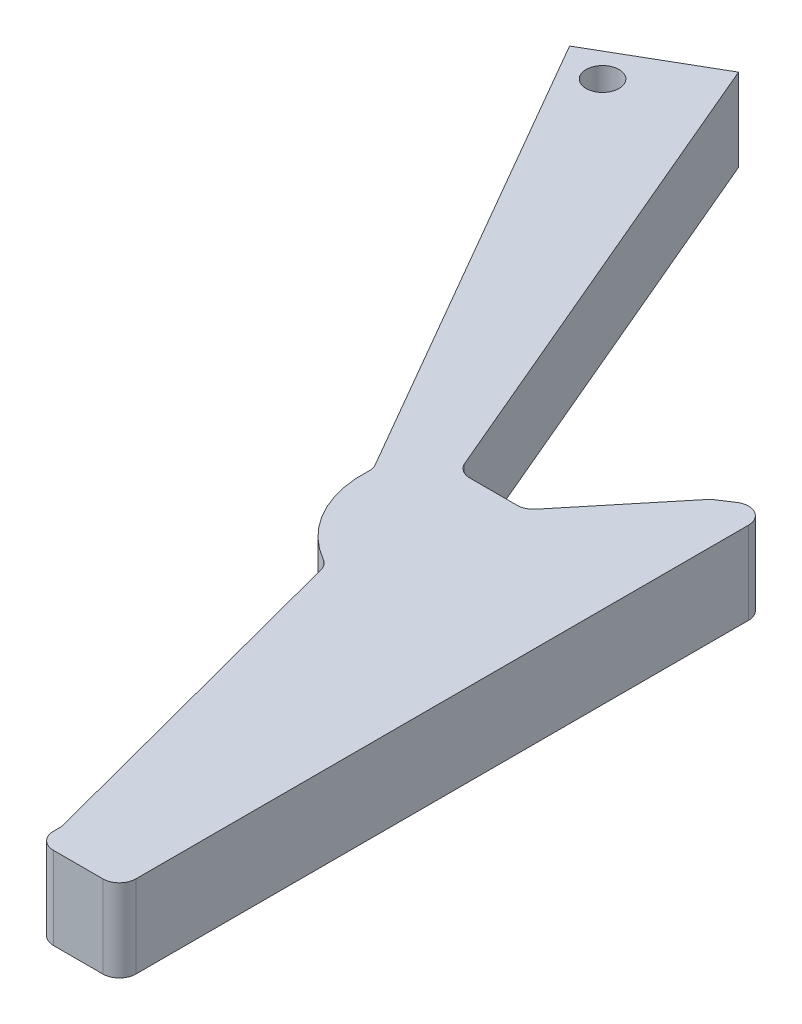
from build123d import *

# Parameters (mm, degrees)
SKETCH1_R           = 2
BOSS_EXTRUDE1_DEPTH = 10
FILLET1_R           = 2


with BuildPart() as part:
    # Sketch1 → Boss-Extrude1 (new body)
    with BuildSketch(Plane(origin=(0, 0, 0), x_dir=(1, 0, 0), z_dir=(0, 1, 0))):
        with BuildLine():
            Line((13.99715319, 15.809310821), (1.006772133, 8.309310821))
            Line((1.006772133, 8.309310821), (33.506772133, -47.982340425))
            ThreePointArc((33.506772133, -47.982340425), (35.087704929, -55.582092399), (40.71773761, -60.926090021))
            Line((40.71773761, -60.926090021), (52.173142167, -104.443600363))
            Line((52.173142167, -104.443600363), (52.173142167, -107.443600363))
            Line((52.173142167, -107.443600363), (62.173142167, -107.443600363))
            Line((62.173142167, -107.443600363), (62.173142167, -27.443600363))
            Line((62.173142167, -27.443600363), (57.158909288, -30.738667683))
            Line((57.158909288, -30.738667683), (47.003945413, -43.1029998))
            Line((47.003945413, -43.1029998), (39.003945413, -43.1029998))
            Line((39.003945413, -43.1029998), (13.99715319, 15.809310821))
        make_face()
        with Locations(Location((6.470873748, 6.845209206, 0), (0, 0, 270))):
            Circle(SKETCH1_R, mode=Mode.SUBTRACT)
    extrude(amount=BOSS_EXTRUDE1_DEPTH)

    # Fillet1
    fillet1_edges = [part.edges().sort_by_distance(p)[0] for p in [
        (39.003945413, 5, 43.1029998),
        (47.003945413, 5, 43.1029998),
        (57.158909288, 5, 30.738667683),
        (62.173142167, 5, 27.443600363),
        (62.173142167, 5, 107.443600363),
        (52.173142167, 5, 107.443600363),
        (52.173142167, 5, 104.443600363),
        (40.71773761, 5, 60.926090021),
        (33.506772133, 5, 47.982340425),
    ]]
    fillet(fillet1_edges, radius=FILLET1_R)


solid = part.part
